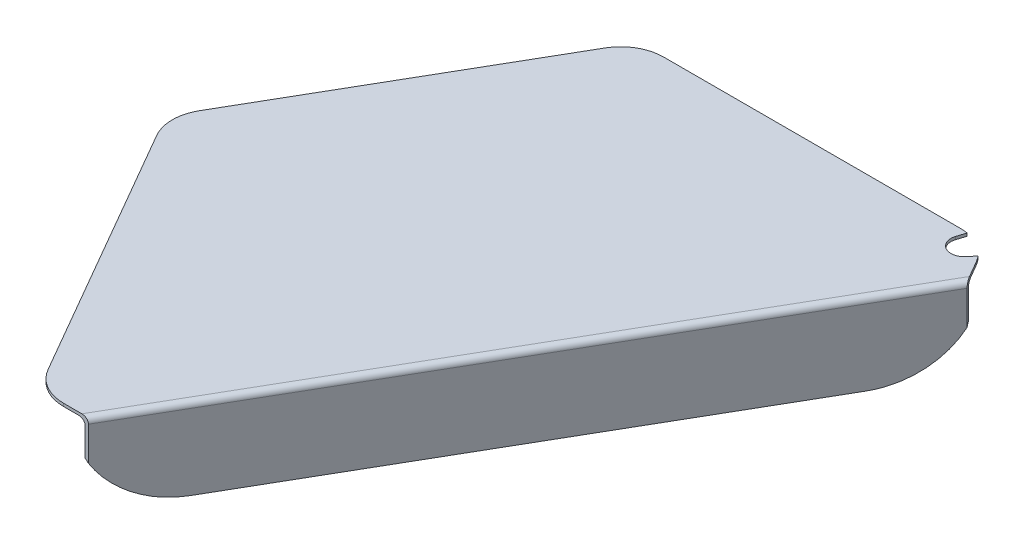
from build123d import *

# Parameters (mm, degrees)
SALIENTE_EXTRUIR1_DEPTH = 1
SALIENTE_EXTRUIR2_DEPTH = 27.5
REDONDEO1_R             = 2
CORTAR_EXTRUIR1_DEPTH   = 3


with BuildPart() as part:
    # Croquis1 → Saliente-Extruir1 (new body)
    with BuildSketch(Plane(origin=(0, 0, 0), x_dir=(1, 0, 0), z_dir=(0, 1, 0))):
        with BuildLine():
            Line((-115.079714212, -8.823380035), (-63.118189984, -98.823380035))
            ThreePointArc((-63.118189984, -98.823380035), (-57.627808928, -104.313761092), (-50.127808928, -106.323380035))
            Line((-50.127808928, -106.323380035), (-41.46755489, -106.323380035))
            Line((-41.46755489, -106.323380035), (71.115747602, 88.676619965))
            Line((71.115747602, 88.676619965), (66.785620583, 96.176619965))
            ThreePointArc((66.785620583, 96.176619965), (66.062943429, 97.308157543), (65.241980727, 98.37054156))
            Line((65.241980727, 98.37054156), (65.207007249, 98.329234857))
            Line((65.207007249, 98.329234857), (63.414251951, 96.211835777))
            ThreePointArc((63.414251951, 96.211835777), (57.625242859, 94.922266282), (55.376892454, 100.410484227))
            Line((55.376892454, 100.410484227), (56.341107438, 103.402342517))
            Line((56.341107438, 103.402342517), (56.358401529, 103.456004274))
            ThreePointArc((56.358401529, 103.456004274), (55.08155896, 103.621364269), (53.795239526, 103.676619965))
            Line((53.795239526, 103.676619965), (-50.127808928, 103.676619965))
            ThreePointArc((-50.127808928, 103.676619965), (-57.627808928, 101.667001022), (-63.118189984, 96.176619965))
            Line((-63.118189984, 96.176619965), (-115.079714212, 6.176619965))
            ThreePointArc((-115.079714212, 6.176619965), (-117.089333155, -1.323380035), (-115.079714212, -8.823380035))
        make_face()
    extrude(amount=SALIENTE_EXTRUIR1_DEPTH)

    # Croquis2 → Saliente-Extruir2 (add)
    with BuildSketch(Plane.XZ):
        Polygon((70.538397333, -89.676619965), (71.115747602, -88.676619965), (-41.46755489, 106.323380035), (-42.622255428, 106.323380035), align=None)
    extrude(amount=SALIENTE_EXTRUIR2_DEPTH)

    # Redondeo1
    redondeo1_edges = [part.edges().sort_by_distance(p)[0] for p in [
        (13.958070952, 0, 8.323380035),
        (14.824096356, 1, 8.823380035),
    ]]
    fillet(redondeo1_edges, radius=REDONDEO1_R)

    # Croquis3 → Cortar-Extruir1 (cut)
    with BuildSketch(Plane(origin=(14.938707896, 0, 8.624867025), x_dir=(0.49999999999999983, 0, -0.8660254037844387), z_dir=(0.8660254037844387, 0, 0.49999999999999983))):
        with BuildLine():
            Line((-117.14265259, 2.577906999), (-128.509159891, -12.943048078))
            Line((-128.509159891, -12.943048078), (-113.226187721, -43.828381759))
            Line((-113.226187721, -43.828381759), (121.292947467, -43.828381759))
            Line((121.292947467, -43.828381759), (140.229409901, -2.708549898))
            Line((140.229409901, -2.708549898), (116.684206431, 2.577906999))
            add(Edge.make_bspline(
                [(86.373317299, -27.422093001), (116.684206431, -27.422093001), (116.684206431, 2.577906999)],
                knots=[1.570796327, 1.570796327, 1.570796327, 3.141592654, 3.141592654, 3.141592654], degree=2, weights=[1, 0.707106781, 1]))
            Line((86.373317299, -27.422093001), (-86.831763458, -27.422093001))
            add(Edge.make_bspline(
                [(-117.14265259, 2.577906999), (-117.14265259, -27.422093001), (-86.831763458, -27.422093001)],
                knots=[3.141592654, 3.141592654, 3.141592654, 4.71238898, 4.71238898, 4.71238898], degree=2, weights=[1, 0.707106781, 1]))
        make_face()
    extrude(amount=-CORTAR_EXTRUIR1_DEPTH, mode=Mode.SUBTRACT)


solid = part.part
